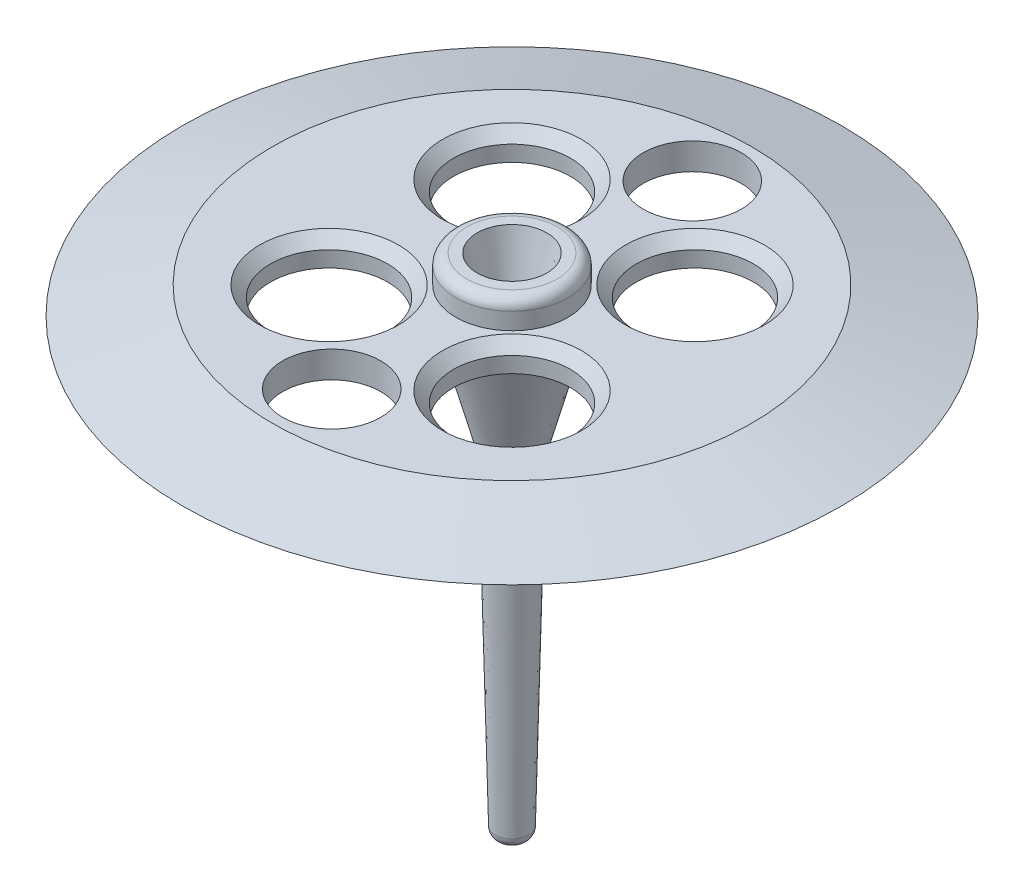
from build123d import *

# Parameters (mm, degrees)
ESQUISSE2_R             = 4.5
ESQUISSE2_R_2           = 5.375
ENL_V_MAT_EXTRU_1_DEPTH = 62.33292353
CHANFREIN2_SIZE         = 1


with BuildPart() as part:
    # Esquisse1 → Révolution1 (revolve)
    with BuildSketch(Plane.XY, mode=Mode.PRIVATE) as r_volution1_sk:
        with BuildLine():
            Line((-5.15, 0), (-30.25, 0))
            Line((-30.25, 0), (-22, 2.45))
            Line((-22, 2.45), (-5.15, 2.45))
            Line((-5.15, 2.45), (-5.15, 4))
            ThreePointArc((-5.15, 4), (-4.857106781, 4.707106781), (-4.15, 5))
            Line((-4.15, 5), (-3.196980896, 5))
            Line((-3.196980896, 5), (-2, 0))
            Line((-2, 0), (0, 0))
            Line((0, 0), (0, -41.5))
            Line((0, -41.5), (-0.522687484, -41.5))
            ThreePointArc((-0.522687484, -41.5), (-1.221634987, -41.215172978), (-1.522424218, -40.522944778))
            Line((-1.522424218, -40.522944778), (-2.197244162, -11.120075793))
            ThreePointArc((-2.197244162, -11.120075793), (-2.207114239, -11.001020564), (-2.231111264, -10.883991897))
            Line((-2.231111264, -10.883991897), (-5.15, 0))
        make_face()
    revolve(r_volution1_sk.sketch.rotate(Axis((0, 0, 0), (0, 1, 0)), 270), axis=Axis((0, 0, 0), (0, 1, 0)))

    # Esquisse2 → Enlèv. mat.-Extru.1 (cut, through all)
    with BuildSketch(Plane(origin=(0, 2.45, 0), x_dir=(1, 0, 0), z_dir=(0, 1, 0))):
        with Locations(Location((0, 16.55, 0), (0, 0, 270))):
            Circle(ESQUISSE2_R)
        with Locations(Location((-8.396893027, 8.396893027, 0), (0, 0, 270))):
            Circle(ESQUISSE2_R_2)
        with Locations(Location((8.396893027, 8.396893027, 0), (0, 0, 270))):
            Circle(ESQUISSE2_R_2)
        with Locations(Location((8.396893027, -8.396893027, 0), (0, 0, 270))):
            Circle(ESQUISSE2_R_2)
        with Locations(Location((0, -16.55, 0), (0, 0, 270))):
            Circle(ESQUISSE2_R)
        with Locations(Location((-8.396893027, -8.396893027, 0), (0, 0, 270))):
            Circle(ESQUISSE2_R_2)
    extrude(amount=-ENL_V_MAT_EXTRU_1_DEPTH, mode=Mode.SUBTRACT)

    # Chanfrein2
    chanfrein2_edges = [part.edges().sort_by_distance(p)[0] for p in [
        (-8.396893027, 2.45, -13.771893027),
        (8.396893027, 2.45, 3.021893027),
        (8.396893027, 2.45, -13.771893027),
        (-8.396893027, 2.45, 3.021893027),
    ]]
    chamfer(chanfrein2_edges, length=CHANFREIN2_SIZE)


solid = part.part
